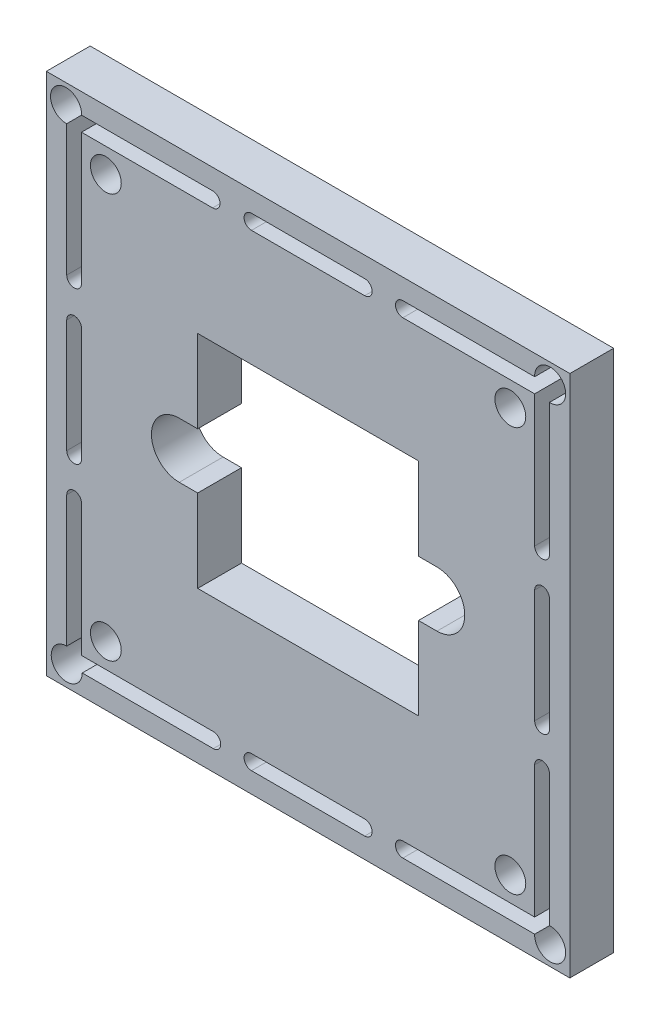
from build123d import *

# Parameters (mm, degrees)
SKETCH1_W           = 37.9349
SKETCH1_H           = 37.9349
BOSS_EXTRUDE1_DEPTH = 3.175
SKETCH9_R           = 1.1176
CUT_EXTRUDE2_DEPTH  = 3.175
SKETCH10_W          = 16.002
SKETCH10_H          = 16.002
CUT_EXTRUDE3_DEPTH  = 3.175
CUT_EXTRUDE4_DEPTH  = 3.175


with BuildPart() as part:
    # Sketch1 → Boss-Extrude1 (new body)
    with BuildSketch(Plane.XY):
        with Locations((18.96745, 18.96745)):
            Rectangle(SKETCH1_W, SKETCH1_H)
    extrude(amount=BOSS_EXTRUDE1_DEPTH)

    # Sketch9 → Cut-Extrude2 (cut)
    with BuildSketch(Plane.XY.offset(3.175)):
        with Locations((33.62325, 33.62325)):
            Circle(SKETCH9_R)
        with Locations((4.31165, 33.62325)):
            Circle(SKETCH9_R)
        with Locations((4.31165, 4.31165)):
            Circle(SKETCH9_R)
        with Locations((33.62325, 4.31165)):
            Circle(SKETCH9_R)
        with BuildLine():
            Line((35.385619933, 12.100169933), (35.385619933, 2.549280067))
            Line((35.385619933, 2.549280067), (25.834730067, 2.549280067))
            ThreePointArc((25.834730067, 2.549280067), (25.2984, 2.01295), (25.834730067, 1.476619933))
            Line((25.834730067, 1.476619933), (35.385619933, 1.476619933))
            ThreePointArc((35.385619933, 1.476619933), (37.303202335, 0.631697665), (36.458280067, 2.549280067))
            Line((36.458280067, 2.549280067), (36.458280067, 12.100169933))
            ThreePointArc((36.458280067, 12.100169933), (35.92195, 12.6365), (35.385619933, 12.100169933))
        make_face()
        with BuildLine():
            Line((35.385619933, 36.458280067), (25.834730067, 36.458280067))
            ThreePointArc((25.834730067, 36.458280067), (25.2984, 35.92195), (25.834730067, 35.385619933))
            Line((25.834730067, 35.385619933), (35.385619933, 35.385619933))
            Line((35.385619933, 35.385619933), (35.385619933, 25.834730067))
            ThreePointArc((35.385619933, 25.834730067), (35.92195, 25.2984), (36.458280067, 25.834730067))
            Line((36.458280067, 25.834730067), (36.458280067, 35.385619933))
            ThreePointArc((36.458280067, 35.385619933), (37.303202335, 37.303202335), (35.385619933, 36.458280067))
        make_face()
        with BuildLine():
            Line((12.048880067, 36.458280067), (2.549280067, 36.458280067))
            ThreePointArc((2.549280067, 36.458280067), (0.631697665, 37.303202335), (1.476619933, 35.385619933))
            Line((1.476619933, 35.385619933), (1.476619933, 25.886019933))
            ThreePointArc((1.476619933, 25.886019933), (2.01295, 25.349689867), (2.549280067, 25.886019933))
            Line((2.549280067, 25.886019933), (2.549280067, 35.385619933))
            Line((2.549280067, 35.385619933), (12.048880067, 35.385619933))
            ThreePointArc((12.048880067, 35.385619933), (12.585210133, 35.92195), (12.048880067, 36.458280067))
        make_face()
        with BuildLine():
            Line((23.06955, 36.458280067), (14.86535, 36.458280067))
            ThreePointArc((14.86535, 36.458280067), (14.329019933, 35.92195), (14.86535, 35.385619933))
            Line((14.86535, 35.385619933), (23.06955, 35.385619933))
            ThreePointArc((23.06955, 35.385619933), (23.605880067, 35.92195), (23.06955, 36.458280067))
        make_face()
        with BuildLine():
            Line((2.549280067, 23.06955), (2.549280067, 14.86535))
            ThreePointArc((2.549280067, 14.86535), (2.01295, 14.329019933), (1.476619933, 14.86535))
            Line((1.476619933, 14.86535), (1.476619933, 23.06955))
            ThreePointArc((1.476619933, 23.06955), (2.01295, 23.605880067), (2.549280067, 23.06955))
        make_face()
        with BuildLine():
            Line((36.458280067, 23.06955), (36.458280067, 14.86535))
            ThreePointArc((36.458280067, 14.86535), (35.92195, 14.329019933), (35.385619933, 14.86535))
            Line((35.385619933, 14.86535), (35.385619933, 23.06955))
            ThreePointArc((35.385619933, 23.06955), (35.92195, 23.605880067), (36.458280067, 23.06955))
        make_face()
        with BuildLine():
            Line((23.06955, 2.549280067), (14.86535, 2.549280067))
            ThreePointArc((14.86535, 2.549280067), (14.329019933, 2.01295), (14.86535, 1.476619933))
            Line((14.86535, 1.476619933), (23.06955, 1.476619933))
            ThreePointArc((23.06955, 1.476619933), (23.605880067, 2.01295), (23.06955, 2.549280067))
        make_face()
        with BuildLine():
            Line((2.549280067, 12.100169933), (2.549280067, 2.549280067))
            Line((2.549280067, 2.549280067), (12.100169933, 2.549280067))
            ThreePointArc((12.100169933, 2.549280067), (12.6365, 2.01295), (12.100169933, 1.476619933))
            Line((12.100169933, 1.476619933), (2.600569933, 1.476619933))
            ThreePointArc((2.600569933, 1.476619933), (0.681867267, 0.681867267), (1.476619933, 2.600569933))
            Line((1.476619933, 2.600569933), (1.476619933, 12.100169933))
            ThreePointArc((1.476619933, 12.100169933), (2.01295, 12.6365), (2.549280067, 12.100169933))
        make_face()
    extrude(amount=-CUT_EXTRUDE2_DEPTH, mode=Mode.SUBTRACT)

    # Sketch10 → Cut-Extrude3 (cut)
    with BuildSketch(Plane(origin=(0, 0, 0), x_dir=(-1, 0, 0), z_dir=(0, 0, -1))):
        with Locations((-18.96745, 18.96745)):
            Rectangle(SKETCH10_W, SKETCH10_H)
    extrude(amount=-CUT_EXTRUDE3_DEPTH, mode=Mode.SUBTRACT)

    # Sketch11 → Cut-Extrude4 (cut)
    with BuildSketch(Plane(origin=(0, 0, 0), x_dir=(-1, 0, 0), z_dir=(0, 0, -1))):
        with BuildLine():
            Line((-10.96645, 16.9545), (-9.62787, 16.9545))
            ThreePointArc((-9.62787, 16.9545), (-7.61492, 18.96745), (-9.62787, 20.9804))
            Line((-9.62787, 20.9804), (-10.96645, 20.9804))
            Line((-10.96645, 20.9804), (-10.96645, 16.9545))
        make_face()
        with BuildLine():
            Line((-28.30703, 20.9804), (-26.96845, 20.9804))
            Line((-26.96845, 20.9804), (-26.96845, 16.9545))
            Line((-26.96845, 16.9545), (-28.30703, 16.9545))
            ThreePointArc((-28.30703, 16.9545), (-30.31998, 18.96745), (-28.30703, 20.9804))
        make_face()
    extrude(amount=-CUT_EXTRUDE4_DEPTH, mode=Mode.SUBTRACT)


solid = part.part
